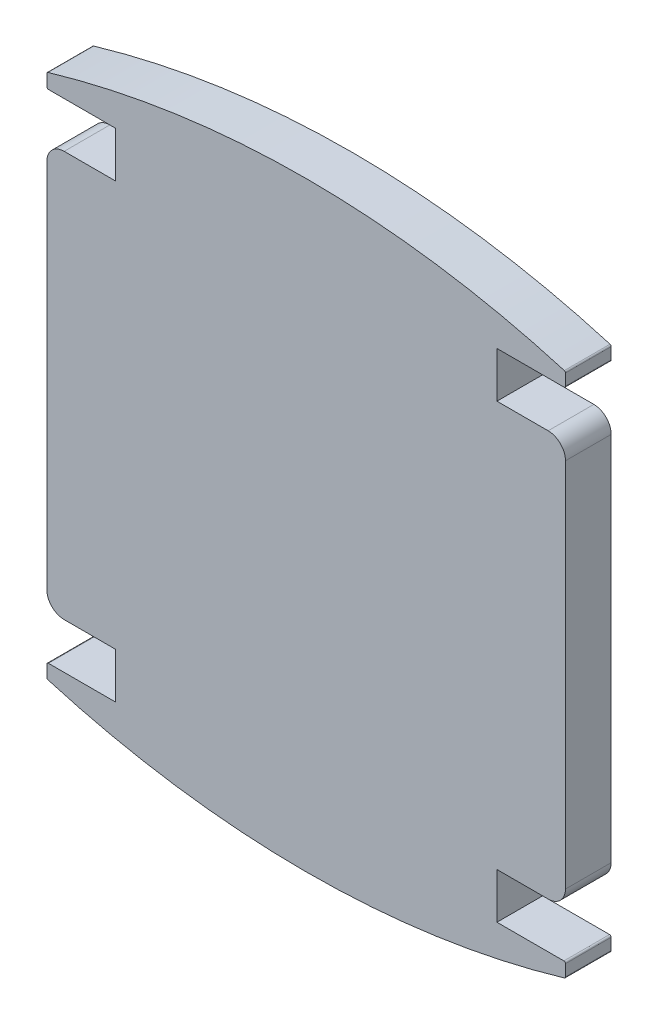
from build123d import *

# Parameters (mm, degrees)
EXTRUDE_1_DEPTH = 2


with BuildPart() as part:
    # 草图1 → 凸台-拉伸1 (new body)
    with BuildSketch(Plane.XY):
        with BuildLine():
            Line((8.35, 10.875), (11.28, 10.875))
            ThreePointArc((11.28, 10.875), (11.329497475, 10.895502525), (11.35, 10.945))
            Line((11.35, 10.945), (11.35, 11.445))
            ThreePointArc((11.35, 11.445), (11.336054538, 11.486927185), (11.299774606, 11.512148827))
            ThreePointArc((11.299774606, 11.512148827), (0, 13.14139051), (-11.299774606, 11.512148827))
            ThreePointArc((-11.299774606, 11.512148827), (-11.336054538, 11.486927185), (-11.35, 11.445))
            Line((-11.35, 11.445), (-11.35, 10.945))
            ThreePointArc((-11.35, 10.945), (-11.329497475, 10.895502525), (-11.28, 10.875))
            Line((-11.28, 10.875), (-8.35, 10.875))
            Line((-8.35, 10.875), (-8.35, 8.875))
            Line((-8.35, 8.875), (-10.591620109, 8.875))
            ThreePointArc((-10.591620109, 8.875), (-11.127875673, 8.652875673), (-11.35, 8.116620109))
            Line((-11.35, 8.116620109), (-11.35, -8.116620109))
            ThreePointArc((-11.35, -8.116620109), (-11.127875673, -8.652875673), (-10.591620109, -8.875))
            Line((-10.591620109, -8.875), (-8.35, -8.875))
            Line((-8.35, -8.875), (-8.35, -10.875))
            Line((-8.35, -10.875), (-11.28, -10.875))
            ThreePointArc((-11.28, -10.875), (-11.329497475, -10.895502525), (-11.35, -10.945))
            Line((-11.35, -10.945), (-11.35, -11.445))
            ThreePointArc((-11.35, -11.445), (-11.336054538, -11.486927185), (-11.299774606, -11.512148827))
            ThreePointArc((-11.299774606, -11.512148827), (0, -13.14139051), (11.299774606, -11.512148827))
            ThreePointArc((11.299774606, -11.512148827), (11.336054538, -11.486927185), (11.35, -11.445))
            Line((11.35, -11.445), (11.35, -10.945))
            ThreePointArc((11.35, -10.945), (11.329497475, -10.895502525), (11.28, -10.875))
            Line((11.28, -10.875), (8.35, -10.875))
            Line((8.35, -10.875), (8.35, -8.875))
            Line((8.35, -8.875), (10.591620109, -8.875))
            ThreePointArc((10.591620109, -8.875), (11.127875673, -8.652875673), (11.35, -8.116620109))
            Line((11.35, -8.116620109), (11.35, 8.116620109))
            ThreePointArc((11.35, 8.116620109), (11.127875673, 8.652875673), (10.591620109, 8.875))
            Line((10.591620109, 8.875), (8.35, 8.875))
            Line((8.35, 8.875), (8.35, 10.875))
        make_face()
    extrude(amount=EXTRUDE_1_DEPTH)


solid = part.part
